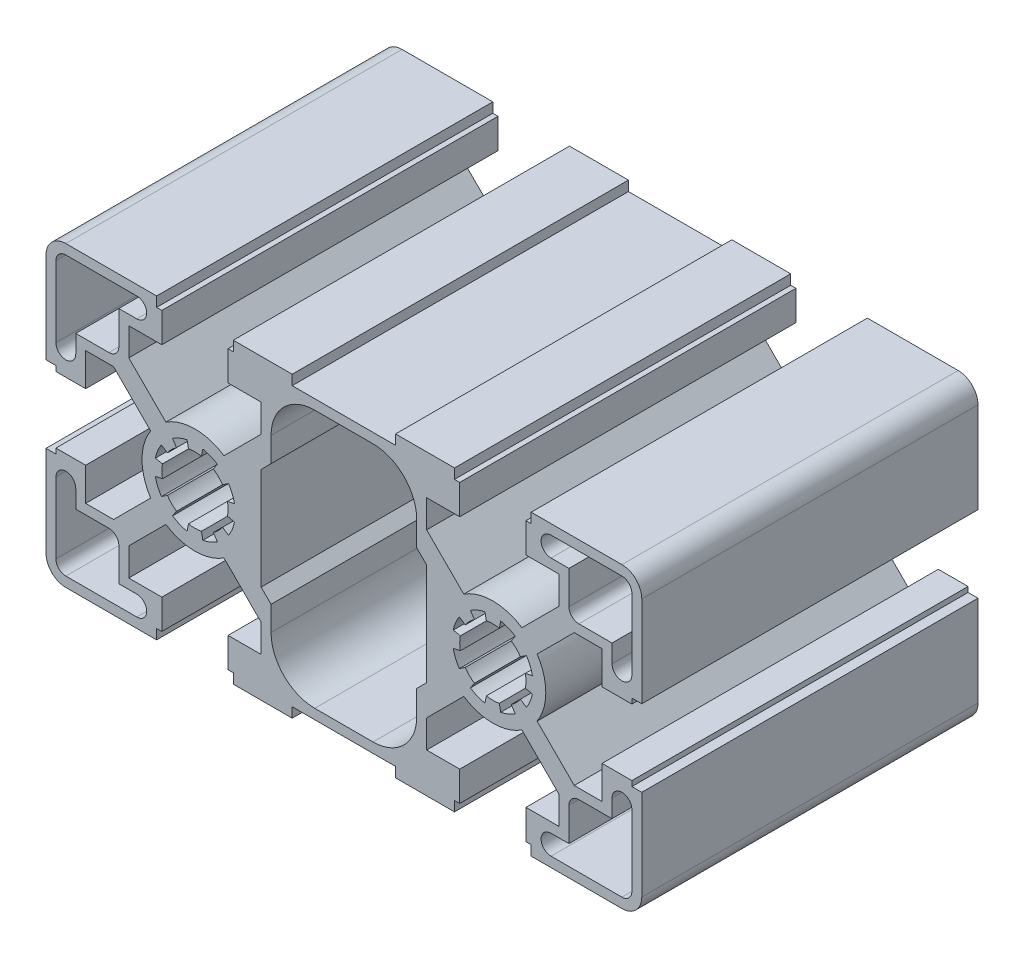
from build123d import *

# Parameters (mm, degrees)
EXTRUDE1_DEPTH = 25.4


with BuildPart() as part:
    # Sketch1 → Extrude1 (new, symmetric)
    with BuildSketch(Plane.XY):
        with BuildLine():
            Line((-19.5072, 22.5044), (-5.7912, 22.5044))
            Line((-5.7912, 22.5044), (-5.7912, 21.0058))
            Line((-5.7912, 21.0058), (-5.0038, 21.0058))
            Line((-5.0038, 21.0058), (-5.0038, 16.51))
            Line((-5.0038, 16.51), (-10, 16.51))
            Line((-10, 16.51), (-10, 12.298945567))
            Line((-10, 12.298945567), (-4.390086118, 6.689031685))
            ThreePointArc((-4.390086118, 6.689031685), (0, 8.001), (4.390086118, 6.689031685))
            Line((4.390086118, 6.689031685), (10, 12.298945567))
            Line((10, 12.298945567), (10, 16.51))
            Line((10, 16.51), (5.0038, 16.51))
            Line((5.0038, 16.51), (5.0038, 21.0058))
            Line((5.0038, 21.0058), (5.7912, 21.0058))
            Line((5.7912, 21.0058), (5.7912, 22.5044))
            Line((5.7912, 22.5044), (14.6939, 22.5044))
            Line((14.6939, 22.5044), (14.6939, 21.0058))
            Line((14.6939, 21.0058), (30.3149, 21.0058))
            Line((30.3149, 21.0058), (30.3149, 22.5044))
            Line((30.3149, 22.5044), (39.2176, 22.5044))
            Line((39.2176, 22.5044), (39.2176, 21.0058))
            Line((39.2176, 21.0058), (40.005, 21.0058))
            Line((40.005, 21.0058), (40.005, 16.51))
            Line((40.005, 16.51), (35.0088, 16.51))
            Line((35.0088, 16.51), (35.0088, 12.298945567))
            Line((35.0088, 12.298945567), (40.618713882, 6.689031685))
            ThreePointArc((40.618713882, 6.689031685), (45.0088, 8.001), (49.398886118, 6.689031685))
            Line((49.398886118, 6.689031685), (55.0088, 12.298945567))
            Line((55.0088, 12.298945567), (55.0088, 16.51))
            Line((55.0088, 16.51), (50.0126, 16.51))
            Line((50.0126, 16.51), (50.0126, 21.0058))
            Line((50.0126, 21.0058), (50.8, 21.0058))
            Line((50.8, 21.0058), (50.8, 22.5044))
            Line((50.8, 22.5044), (64.516, 22.5044))
            ThreePointArc((64.516, 22.5044), (66.635340445, 21.626540445), (67.5132, 19.5072))
            Line((67.5132, 19.5072), (67.5132, 5.7912))
            Line((67.5132, 5.7912), (66.0146, 5.7912))
            Line((66.0146, 5.7912), (66.0146, 5.0038))
            Line((66.0146, 5.0038), (61.5188, 5.0038))
            Line((61.5188, 5.0038), (61.5188, 10))
            Line((61.5188, 10), (57.307745567, 10))
            Line((57.307745567, 10), (51.697831685, 4.390086118))
            ThreePointArc((51.697831685, 4.390086118), (53.0098, 0), (51.697831685, -4.390086118))
            Line((51.697831685, -4.390086118), (57.307745567, -10))
            Line((57.307745567, -10), (61.5188, -10))
            Line((61.5188, -10), (61.5188, -5.0038))
            Line((61.5188, -5.0038), (66.0146, -5.0038))
            Line((66.0146, -5.0038), (66.0146, -5.7912))
            Line((66.0146, -5.7912), (67.5132, -5.7912))
            Line((67.5132, -5.7912), (67.5132, -19.5072))
            ThreePointArc((67.5132, -19.5072), (66.635340445, -21.626540445), (64.516, -22.5044))
            Line((64.516, -22.5044), (50.8, -22.5044))
            Line((50.8, -22.5044), (50.8, -21.0058))
            Line((50.8, -21.0058), (50.0126, -21.0058))
            Line((50.0126, -21.0058), (50.0126, -16.51))
            Line((50.0126, -16.51), (55.0088, -16.51))
            Line((55.0088, -16.51), (55.0088, -12.298945567))
            Line((55.0088, -12.298945567), (49.398886118, -6.689031685))
            ThreePointArc((49.398886118, -6.689031685), (45.0088, -8.001), (40.618713882, -6.689031685))
            Line((40.618713882, -6.689031685), (35.0088, -12.298945567))
            Line((35.0088, -12.298945567), (35.0088, -16.51))
            Line((35.0088, -16.51), (40.005, -16.51))
            Line((40.005, -16.51), (40.005, -21.0058))
            Line((40.005, -21.0058), (39.2176, -21.0058))
            Line((39.2176, -21.0058), (39.2176, -22.5044))
            Line((39.2176, -22.5044), (30.3149, -22.5044))
            Line((30.3149, -22.5044), (30.3149, -21.0058))
            Line((30.3149, -21.0058), (14.6939, -21.0058))
            Line((14.6939, -21.0058), (14.6939, -22.5044))
            Line((14.6939, -22.5044), (5.7912, -22.5044))
            Line((5.7912, -22.5044), (5.7912, -21.0058))
            Line((5.7912, -21.0058), (5.0038, -21.0058))
            Line((5.0038, -21.0058), (5.0038, -16.51))
            Line((5.0038, -16.51), (10, -16.51))
            Line((10, -16.51), (10, -12.298945567))
            Line((10, -12.298945567), (4.390086118, -6.689031685))
            ThreePointArc((4.390086118, -6.689031685), (0, -8.001), (-4.390086118, -6.689031685))
            Line((-4.390086118, -6.689031685), (-10, -12.298945567))
            Line((-10, -12.298945567), (-10, -16.51))
            Line((-10, -16.51), (-5.0038, -16.51))
            Line((-5.0038, -16.51), (-5.0038, -21.0058))
            Line((-5.0038, -21.0058), (-5.7912, -21.0058))
            Line((-5.7912, -21.0058), (-5.7912, -22.5044))
            Line((-5.7912, -22.5044), (-19.5072, -22.5044))
            ThreePointArc((-19.5072, -22.5044), (-21.626540445, -21.626540445), (-22.5044, -19.5072))
            Line((-22.5044, -19.5072), (-22.5044, -5.7912))
            Line((-22.5044, -5.7912), (-21.0058, -5.7912))
            Line((-21.0058, -5.7912), (-21.0058, -5.0038))
            Line((-21.0058, -5.0038), (-16.51, -5.0038))
            Line((-16.51, -5.0038), (-16.51, -10))
            Line((-16.51, -10), (-12.298945567, -10))
            Line((-12.298945567, -10), (-6.689031685, -4.390086118))
            ThreePointArc((-6.689031685, -4.390086118), (-8.001, 0), (-6.689031685, 4.390086118))
            Line((-6.689031685, 4.390086118), (-12.298945567, 10))
            Line((-12.298945567, 10), (-16.51, 10))
            Line((-16.51, 10), (-16.51, 5.0038))
            Line((-16.51, 5.0038), (-21.0058, 5.0038))
            Line((-21.0058, 5.0038), (-21.0058, 5.7912))
            Line((-21.0058, 5.7912), (-22.5044, 5.7912))
            Line((-22.5044, 5.7912), (-22.5044, 19.5072))
            ThreePointArc((-22.5044, 19.5072), (-21.626540445, 21.626540445), (-19.5072, 22.5044))
        make_face()
        with BuildLine():
            Line((-18.0086, 11.4986), (-12.9972, 11.4986))
            ThreePointArc((-12.9972, 11.4986), (-11.937529778, 11.937529778), (-11.4986, 12.9972))
            Line((-11.4986, 12.9972), (-11.4986, 18.0086))
            Line((-11.4986, 18.0086), (-8.7884, 18.0086))
            ThreePointArc((-8.7884, 18.0086), (-7.2898, 19.5072), (-8.7884, 21.0058))
            Line((-8.7884, 21.0058), (-19.5072, 21.0058))
            ThreePointArc((-19.5072, 21.0058), (-20.566870222, 20.566870222), (-21.0058, 19.5072))
            Line((-21.0058, 19.5072), (-21.0058, 8.7884))
            ThreePointArc((-21.0058, 8.7884), (-19.5072, 7.2898), (-18.0086, 8.7884))
            Line((-18.0086, 8.7884), (-18.0086, 11.4986))
        make_face(mode=Mode.SUBTRACT)
        with BuildLine():
            Line((1.189270603, 5.978867069), (0.976192953, 4.907653386))
            ThreePointArc((0.976192953, 4.907653386), (0, 5.0038), (-0.976192953, 4.907653386))
            Line((-0.976192953, 4.907653386), (-1.189270603, 5.978867069))
            ThreePointArc((-1.189270603, 5.978867069), (-2.332838204, 5.63196963), (-3.38675614, 5.068638757))
            Line((-3.38675614, 5.068638757), (-2.779962332, 4.160507646))
            ThreePointArc((-2.779962332, 4.160507646), (-3.538220912, 3.538220912), (-4.160507646, 2.779962332))
            Line((-4.160507646, 2.779962332), (-5.068638757, 3.38675614))
            ThreePointArc((-5.068638757, 3.38675614), (-5.63196963, 2.332838204), (-5.978867069, 1.189270603))
            Line((-5.978867069, 1.189270603), (-4.907653386, 0.976192953))
            ThreePointArc((-4.907653386, 0.976192953), (-5.0038, 0), (-4.907653386, -0.976192953))
            Line((-4.907653386, -0.976192953), (-5.978867069, -1.189270603))
            ThreePointArc((-5.978867069, -1.189270603), (-5.63196963, -2.332838204), (-5.068638757, -3.38675614))
            Line((-5.068638757, -3.38675614), (-4.160507646, -2.779962332))
            ThreePointArc((-4.160507646, -2.779962332), (-3.538220912, -3.538220912), (-2.779962332, -4.160507646))
            Line((-2.779962332, -4.160507646), (-3.38675614, -5.068638757))
            ThreePointArc((-3.38675614, -5.068638757), (-2.332838204, -5.63196963), (-1.189270603, -5.978867069))
            Line((-1.189270603, -5.978867069), (-0.976192953, -4.907653386))
            ThreePointArc((-0.976192953, -4.907653386), (0, -5.0038), (0.976192953, -4.907653386))
            Line((0.976192953, -4.907653386), (1.189270603, -5.978867069))
            ThreePointArc((1.189270603, -5.978867069), (2.332838204, -5.63196963), (3.38675614, -5.068638757))
            Line((3.38675614, -5.068638757), (2.779962332, -4.160507646))
            ThreePointArc((2.779962332, -4.160507646), (3.538220912, -3.538220912), (4.160507646, -2.779962332))
            Line((4.160507646, -2.779962332), (5.068638757, -3.38675614))
            ThreePointArc((5.068638757, -3.38675614), (5.63196963, -2.332838204), (5.978867069, -1.189270603))
            Line((5.978867069, -1.189270603), (4.907653386, -0.976192953))
            ThreePointArc((4.907653386, -0.976192953), (5.0038, 0), (4.907653386, 0.976192953))
            Line((4.907653386, 0.976192953), (5.978867069, 1.189270603))
            ThreePointArc((5.978867069, 1.189270603), (5.63196963, 2.332838204), (5.068638757, 3.38675614))
            Line((5.068638757, 3.38675614), (4.160507646, 2.779962332))
            ThreePointArc((4.160507646, 2.779962332), (3.538220912, 3.538220912), (2.779962332, 4.160507646))
            Line((2.779962332, 4.160507646), (3.38675614, 5.068638757))
            ThreePointArc((3.38675614, 5.068638757), (2.332838204, 5.63196963), (1.189270603, 5.978867069))
        make_face(mode=Mode.SUBTRACT)
        with BuildLine():
            Line((11.4986, 9.199654433), (10, 7.701054433))
            Line((10, 7.701054433), (10, -7.701054433))
            Line((10, -7.701054433), (11.4986, -9.199654433))
            Line((11.4986, -9.199654433), (11.4986, -12.9032))
            ThreePointArc((11.4986, -12.9032), (13.432866817, -17.572933183), (18.1026, -19.5072))
            Line((18.1026, -19.5072), (26.9062, -19.5072))
            ThreePointArc((26.9062, -19.5072), (31.575933183, -17.572933183), (33.5102, -12.9032))
            Line((33.5102, -12.9032), (33.5102, -9.199654433))
            Line((33.5102, -9.199654433), (35.0088, -7.701054433))
            Line((35.0088, -7.701054433), (35.0088, 7.701054433))
            Line((35.0088, 7.701054433), (33.5102, 9.199654433))
            Line((33.5102, 9.199654433), (33.5102, 12.9032))
            ThreePointArc((33.5102, 12.9032), (31.575933183, 17.572933183), (26.9062, 19.5072))
            Line((26.9062, 19.5072), (18.1026, 19.5072))
            ThreePointArc((18.1026, 19.5072), (13.432866817, 17.572933183), (11.4986, 12.9032))
            Line((11.4986, 12.9032), (11.4986, 9.199654433))
        make_face(mode=Mode.SUBTRACT)
        with BuildLine():
            Line((-18.0086, -11.4986), (-12.9972, -11.4986))
            ThreePointArc((-12.9972, -11.4986), (-11.937529778, -11.937529778), (-11.4986, -12.9972))
            Line((-11.4986, -12.9972), (-11.4986, -18.0086))
            Line((-11.4986, -18.0086), (-8.7884, -18.0086))
            ThreePointArc((-8.7884, -18.0086), (-7.2898, -19.5072), (-8.7884, -21.0058))
            Line((-8.7884, -21.0058), (-19.5072, -21.0058))
            ThreePointArc((-19.5072, -21.0058), (-20.566870222, -20.566870222), (-21.0058, -19.5072))
            Line((-21.0058, -19.5072), (-21.0058, -8.7884))
            ThreePointArc((-21.0058, -8.7884), (-19.5072, -7.2898), (-18.0086, -8.7884))
            Line((-18.0086, -8.7884), (-18.0086, -11.4986))
        make_face(mode=Mode.SUBTRACT)
        with BuildLine():
            Line((64.516, 21.0058), (53.7972, 21.0058))
            ThreePointArc((53.7972, 21.0058), (52.2986, 19.5072), (53.7972, 18.0086))
            Line((53.7972, 18.0086), (56.5074, 18.0086))
            Line((56.5074, 18.0086), (56.5074, 12.9972))
            ThreePointArc((56.5074, 12.9972), (56.946329778, 11.937529778), (58.006, 11.4986))
            Line((58.006, 11.4986), (63.0174, 11.4986))
            Line((63.0174, 11.4986), (63.0174, 8.7884))
            ThreePointArc((63.0174, 8.7884), (64.516, 7.2898), (66.0146, 8.7884))
            Line((66.0146, 8.7884), (66.0146, 19.5072))
            ThreePointArc((66.0146, 19.5072), (65.575670222, 20.566870222), (64.516, 21.0058))
        make_face(mode=Mode.SUBTRACT)
        with BuildLine():
            Line((63.0174, -11.4986), (58.006, -11.4986))
            ThreePointArc((58.006, -11.4986), (56.946329778, -11.937529778), (56.5074, -12.9972))
            Line((56.5074, -12.9972), (56.5074, -18.0086))
            Line((56.5074, -18.0086), (53.7972, -18.0086))
            ThreePointArc((53.7972, -18.0086), (52.2986, -19.5072), (53.7972, -21.0058))
            Line((53.7972, -21.0058), (64.516, -21.0058))
            ThreePointArc((64.516, -21.0058), (65.575670222, -20.566870222), (66.0146, -19.5072))
            Line((66.0146, -19.5072), (66.0146, -8.7884))
            ThreePointArc((66.0146, -8.7884), (64.516, -7.2898), (63.0174, -8.7884))
            Line((63.0174, -8.7884), (63.0174, -11.4986))
        make_face(mode=Mode.SUBTRACT)
        with BuildLine():
            Line((50.077438757, 3.38675614), (49.169307646, 2.779962332))
            ThreePointArc((49.169307646, 2.779962332), (48.547020912, 3.538220912), (47.788762332, 4.160507646))
            Line((47.788762332, 4.160507646), (48.39555614, 5.068638757))
            ThreePointArc((48.39555614, 5.068638757), (47.341638204, 5.63196963), (46.198070603, 5.978867069))
            Line((46.198070603, 5.978867069), (45.984992953, 4.907653386))
            ThreePointArc((45.984992953, 4.907653386), (45.0088, 5.0038), (44.032607047, 4.907653386))
            Line((44.032607047, 4.907653386), (43.819529397, 5.978867069))
            ThreePointArc((43.819529397, 5.978867069), (42.675961796, 5.63196963), (41.62204386, 5.068638757))
            Line((41.62204386, 5.068638757), (42.228837668, 4.160507646))
            ThreePointArc((42.228837668, 4.160507646), (41.470579088, 3.538220912), (40.848292354, 2.779962332))
            Line((40.848292354, 2.779962332), (39.940161243, 3.38675614))
            ThreePointArc((39.940161243, 3.38675614), (39.37683037, 2.332838204), (39.029932931, 1.189270603))
            Line((39.029932931, 1.189270603), (40.101146614, 0.976192953))
            ThreePointArc((40.101146614, 0.976192953), (40.005, 0), (40.101146614, -0.976192953))
            Line((40.101146614, -0.976192953), (39.029932931, -1.189270603))
            ThreePointArc((39.029932931, -1.189270603), (39.37683037, -2.332838204), (39.940161243, -3.38675614))
            Line((39.940161243, -3.38675614), (40.848292354, -2.779962332))
            ThreePointArc((40.848292354, -2.779962332), (41.470579088, -3.538220912), (42.228837668, -4.160507646))
            Line((42.228837668, -4.160507646), (41.62204386, -5.068638757))
            ThreePointArc((41.62204386, -5.068638757), (42.675961796, -5.63196963), (43.819529397, -5.978867069))
            Line((43.819529397, -5.978867069), (44.032607047, -4.907653386))
            ThreePointArc((44.032607047, -4.907653386), (45.0088, -5.0038), (45.984992953, -4.907653386))
            Line((45.984992953, -4.907653386), (46.198070603, -5.978867069))
            ThreePointArc((46.198070603, -5.978867069), (47.341638204, -5.63196963), (48.39555614, -5.068638757))
            Line((48.39555614, -5.068638757), (47.788762332, -4.160507646))
            ThreePointArc((47.788762332, -4.160507646), (48.547020912, -3.538220912), (49.169307646, -2.779962332))
            Line((49.169307646, -2.779962332), (50.077438757, -3.38675614))
            ThreePointArc((50.077438757, -3.38675614), (50.64076963, -2.332838204), (50.987667069, -1.189270603))
            Line((50.987667069, -1.189270603), (49.916453386, -0.976192953))
            ThreePointArc((49.916453386, -0.976192953), (50.0126, 0), (49.916453386, 0.976192953))
            Line((49.916453386, 0.976192953), (50.987667069, 1.189270603))
            ThreePointArc((50.987667069, 1.189270603), (50.64076963, 2.332838204), (50.077438757, 3.38675614))
        make_face(mode=Mode.SUBTRACT)
    extrude(amount=EXTRUDE1_DEPTH, both=True)


solid = part.part
